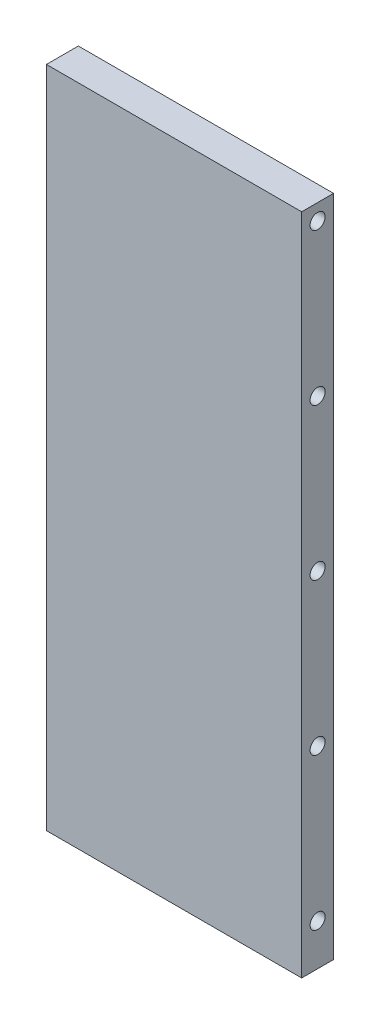
from build123d import *

# Parameters (mm, degrees)
CROQUIS1_W              = 80
CROQUIS1_H              = 200
SALIENTE_EXTRUIR1_DEPTH = 10
CROQUIS3_R              = 2.35
CORTAR_EXTRUIR2_DEPTH   = 5
CORTAR_EXTRUIR3_START   = -5
CROQUIS4_R              = 2.35
CORTAR_EXTRUIR3_DEPTH   = 5
CROQUIS5_W              = 80
CROQUIS5_H              = 8
SALIENTE_EXTRUIR2_DEPTH = 10


with BuildPart() as part:
    # Croquis1 → Saliente-Extruir1 (new body)
    with BuildSketch(Plane.XY):
        with Locations((40, 100)):
            Rectangle(CROQUIS1_W, CROQUIS1_H)
    extrude(amount=SALIENTE_EXTRUIR1_DEPTH)

    # Croquis3 → Cortar-Extruir2 (cut)
    with BuildSketch(Plane.ZY):
        with Locations(Location((5, 195, 0), (0, 0, 270))):
            Circle(CROQUIS3_R)
        with Locations(Location((5, 147.5, 0), (0, 0, 270))):
            Circle(CROQUIS3_R)
        with Locations(Location((5, 100, 0), (0, 0, 270))):
            Circle(CROQUIS3_R)
        with Locations(Location((5, 52.5, 0), (0, 0, 270))):
            Circle(CROQUIS3_R)
        with Locations(Location((5, 5, 0), (0, 0, 270))):
            Circle(CROQUIS3_R)
    extrude(amount=-CORTAR_EXTRUIR2_DEPTH, mode=Mode.SUBTRACT)

    # Croquis4 → Cortar-Extruir3 (cut)
    with BuildSketch(Plane(origin=(80, 0, 0), x_dir=(0, 0, -1), z_dir=(1, 0, 0)).offset(CORTAR_EXTRUIR3_START)):
        with Locations(Location((-5, 195, 0), (0, 0, 270))):
            Circle(CROQUIS4_R)
        with Locations(Location((-5, 147.5, 0), (0, 0, 270))):
            Circle(CROQUIS4_R)
        with Locations(Location((-5, 100, 0), (0, 0, 270))):
            Circle(CROQUIS4_R)
        with Locations(Location((-5, 52.5, 0), (0, 0, 270))):
            Circle(CROQUIS4_R)
        with Locations(Location((-5, 5, 0), (0, 0, 270))):
            Circle(CROQUIS4_R)
    extrude(amount=CORTAR_EXTRUIR3_DEPTH, mode=Mode.SUBTRACT)

    # Croquis5 → Saliente-Extruir2 (add)
    with BuildSketch(Plane(origin=(0, 0, 0), x_dir=(-1, 0, 0), z_dir=(0, 0, -1))):
        with Locations((-40, -4)):
            Rectangle(CROQUIS5_W, CROQUIS5_H)
    extrude(amount=-SALIENTE_EXTRUIR2_DEPTH)


solid = part.part
